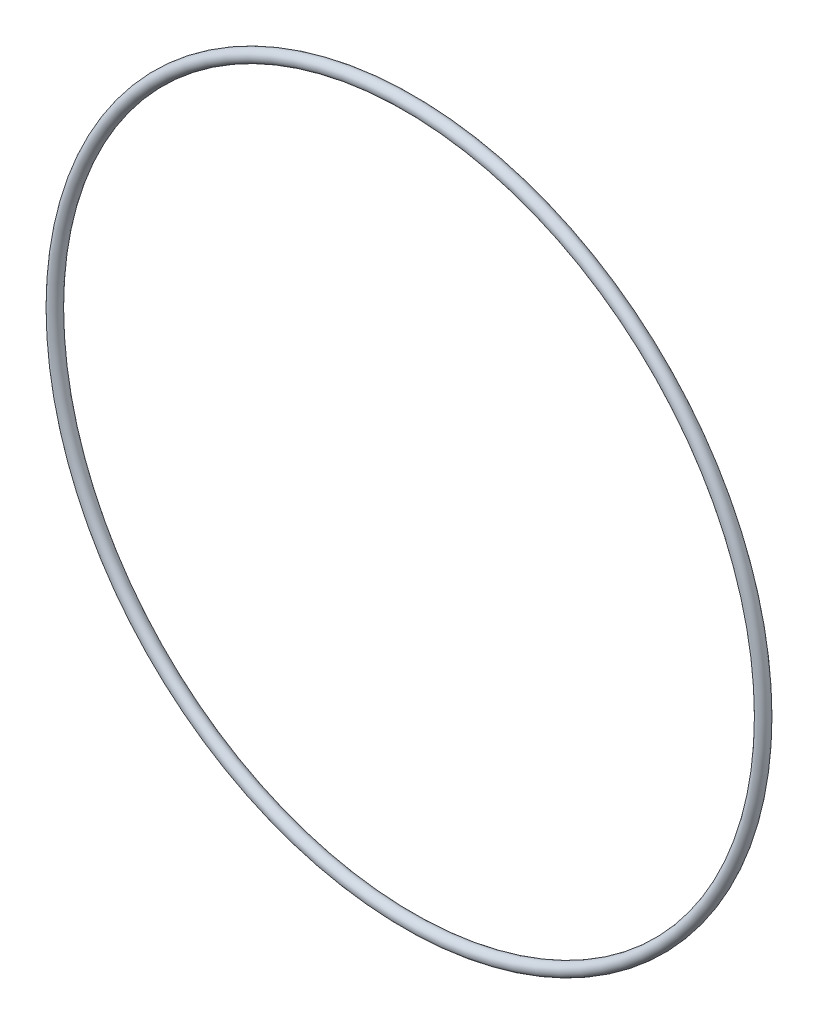
from build123d import *

# Parameters (mm, degrees)
SKETCH1_R = 1.5


with BuildPart() as part:
    # Sketch1 → Revolve1 (revolve)
    with BuildSketch(Plane.ZY):
        with Locations((0, 85.5)):
            Circle(SKETCH1_R)
    revolve(axis=Axis((0, 0, 0), (0, 0, -1)))


solid = part.part
